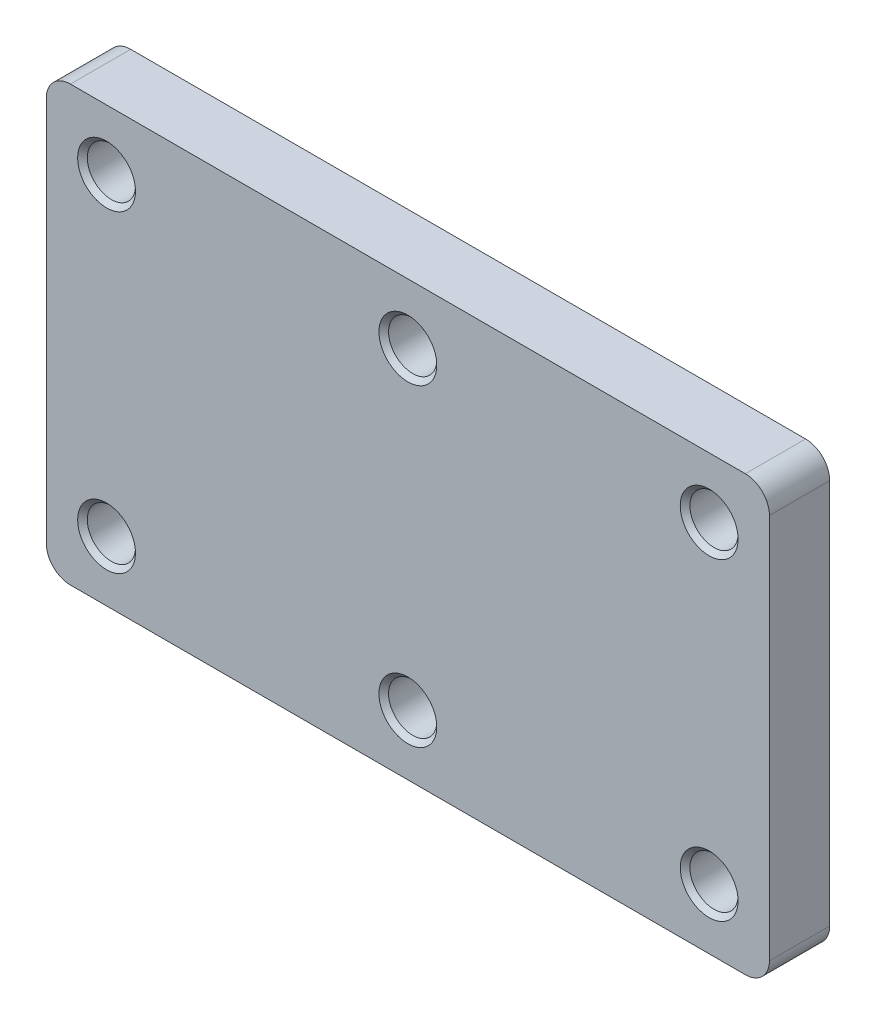
from build123d import *

# Parameters (mm, degrees)
SKETCH_1_W       = 300
SKETCH_1_H       = 180
EXTRUDE_1_DEPTH  = 25
FILLET_1_R       = 10
F_20_0MM_1_D     = 20
F_20_0MM_1_DEPTH = 59
F_20_0MM_1_TIP   = 6.00860619
F_20_0MM_2_D     = 20
F_20_0MM_2_DEPTH = 59
F_20_0MM_2_TIP   = 6.00860619
CHAMFER_1_SIZE   = 2


with BuildPart() as part:
    # 草圖1 → 填料-伸長1 (new body)
    with BuildSketch(Plane.XY):
        with Locations((150, 90)):
            Rectangle(SKETCH_1_W, SKETCH_1_H)
    extrude(amount=EXTRUDE_1_DEPTH)

    # 圓角1
    fillet_1_edges = [part.edges().sort_by_distance(p)[0] for p in [
        (0, 180, 12.5),
        (300, 180, 12.5),
        (300, 0, 12.5),
        (0, 0, 12.5),
    ]]
    fillet(fillet_1_edges, radius=FILLET_1_R)

    # Ø20.0mm 定位孔1
    with Locations(Plane(origin=(25, 25, 25), x_dir=(1, 0, 0), z_dir=(0, 0, 1))):
        with Locations((0, 0), (0, 130), (125, 130), (250, 0), (250, 130)):
            Hole(F_20_0MM_1_D / 2, depth=F_20_0MM_1_DEPTH)
            with Locations((0, 0, -(F_20_0MM_1_DEPTH + F_20_0MM_1_TIP / 2))):  # 118° drill point
                Cone(0, F_20_0MM_1_D / 2, F_20_0MM_1_TIP, mode=Mode.SUBTRACT)

    # Ø20.0mm 定位孔2
    with Locations(Plane(origin=(150, 25, 25), x_dir=(1, 0, 0), z_dir=(0, 0, 1))):
        with Locations((0, 0)):
            Hole(F_20_0MM_2_D / 2, depth=F_20_0MM_2_DEPTH)
            with Locations((0, 0, -(F_20_0MM_2_DEPTH + F_20_0MM_2_TIP / 2))):  # 118° drill point
                Cone(0, F_20_0MM_2_D / 2, F_20_0MM_2_TIP, mode=Mode.SUBTRACT)

    # 導角1
    chamfer_1_edges = [part.edges().sort_by_distance(p)[0] for p in [
        (285, 155, 0),
        (285, 155, 25),
        (285, 25, 0),
        (285, 25, 25),
        (160, 155, 0),
        (160, 155, 25),
        (35, 155, 0),
        (35, 155, 25),
        (35, 25, 0),
        (35, 25, 25),
        (160, 25, 0),
        (160, 25, 25),
    ]]
    chamfer(chamfer_1_edges, length=CHAMFER_1_SIZE)


solid = part.part
